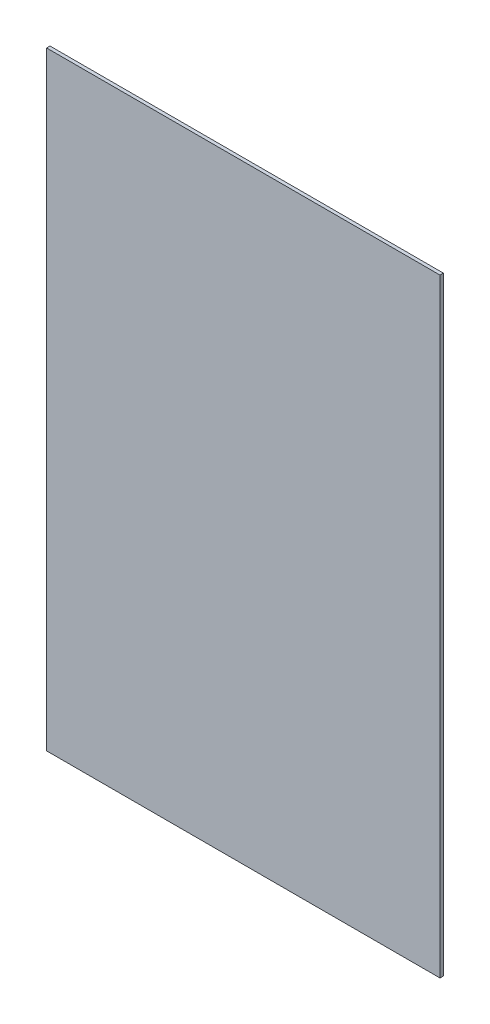
from build123d import *

# Parameters (mm, degrees)
ESQUISSE1_W        = 368.3
ESQUISSE1_H        = 570
BOSS_EXTRU_1_DEPTH = 3.175


with BuildPart() as part:
    # Esquisse1 → Boss.-Extru.1 (new body)
    with BuildSketch(Plane.XY):
        Rectangle(ESQUISSE1_W, ESQUISSE1_H)
    extrude(amount=BOSS_EXTRU_1_DEPTH)


solid = part.part
